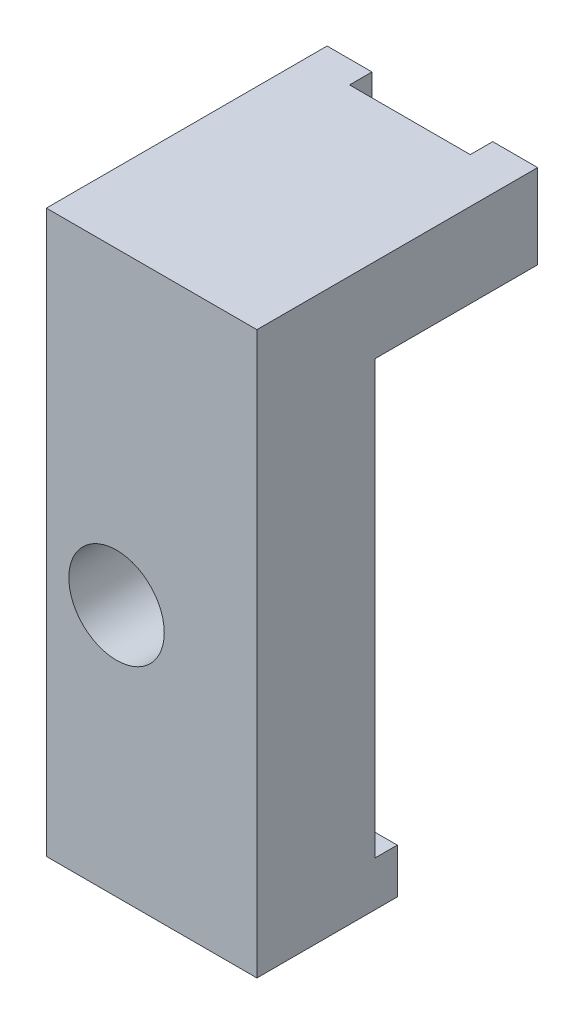
from build123d import *

# Parameters (mm, degrees)
SKETCH1_W           = 9.525
SKETCH1_H           = 25.4
BOSS_EXTRUDE1_DEPTH = 6.35
CUT_EXTRUDE1_REACH  = 19.098
SKETCH2_W           = 6.35
SKETCH2_H           = 21.59
CUT_EXTRUDE2_REACH  = 20.581
SKETCH3_R           = 2.159
CUT_EXTRUDE3_REACH  = 28.611
SKETCH4_W           = 5.461
SKETCH4_H           = 1.016
SKETCH5_W           = 1.016
SKETCH5_H           = 19.558
CUT_EXTRUDE4_DEPTH  = 18.097898263


with BuildPart() as part:
    # Sketch1 → Boss-Extrude1 (new, symmetric)
    with BuildSketch(Plane.XY):
        Rectangle(SKETCH1_W, SKETCH1_H)
    extrude(amount=BOSS_EXTRUDE1_DEPTH, both=True)

    # Sketch2 → Cut-Extrude1 (cut, up to next)
    with BuildSketch(Plane(origin=(4.7625, 0, 0), x_dir=(0, 0, -1), z_dir=(1, 0, 0)), mode=Mode.PRIVATE) as cut_extrude1_sk1:
        with Locations((3.175, -1.905)):
            Rectangle(SKETCH2_W, SKETCH2_H)
    cut_extrude1_tool1 = extrude(cut_extrude1_sk1.sketch, amount=-CUT_EXTRUDE1_REACH, mode=Mode.PRIVATE) & part.part
    add(cut_extrude1_tool1.solids().sort_by_distance((4.7625, -1.905, -3.175))[0], mode=Mode.SUBTRACT)

    # Sketch3 → Cut-Extrude2 (cut, up to next)
    with BuildSketch(Plane.XY.offset(6.35), mode=Mode.PRIVATE) as cut_extrude2_sk1:
        with Locations((-1.5875, -1.27)):
            Circle(SKETCH3_R)
    cut_extrude2_tool1 = extrude(cut_extrude2_sk1.sketch, amount=-CUT_EXTRUDE2_REACH, mode=Mode.PRIVATE) & part.part
    add(cut_extrude2_tool1.solids().sort_by_distance((-1.5875, -1.27, 6.35))[0], mode=Mode.SUBTRACT)

    # Sketch4 → Cut-Extrude3 (cut, up to next)
    with BuildSketch(Plane(origin=(0, 12.7, 0), x_dir=(1, 0, 0), z_dir=(0, 1, 0)), mode=Mode.PRIVATE) as cut_extrude3_sk1:
        with Locations((0, 5.842)):
            Rectangle(SKETCH4_W, SKETCH4_H)
    cut_extrude3_tool1 = extrude(cut_extrude3_sk1.sketch, amount=-CUT_EXTRUDE3_REACH, mode=Mode.PRIVATE) & part.part
    add(cut_extrude3_tool1.solids().sort_by_distance((0, 12.7, -5.842))[0], mode=Mode.SUBTRACT)

    # Sketch5 → Cut-Extrude4 (cut, through all)
    with BuildSketch(Plane(origin=(4.7625, 0, 0), x_dir=(0, 0, -1), z_dir=(1, 0, 0))):
        with Locations((-0.508, -0.889)):
            Rectangle(SKETCH5_W, SKETCH5_H)
    extrude(amount=-CUT_EXTRUDE4_DEPTH, mode=Mode.SUBTRACT)


solid = part.part
